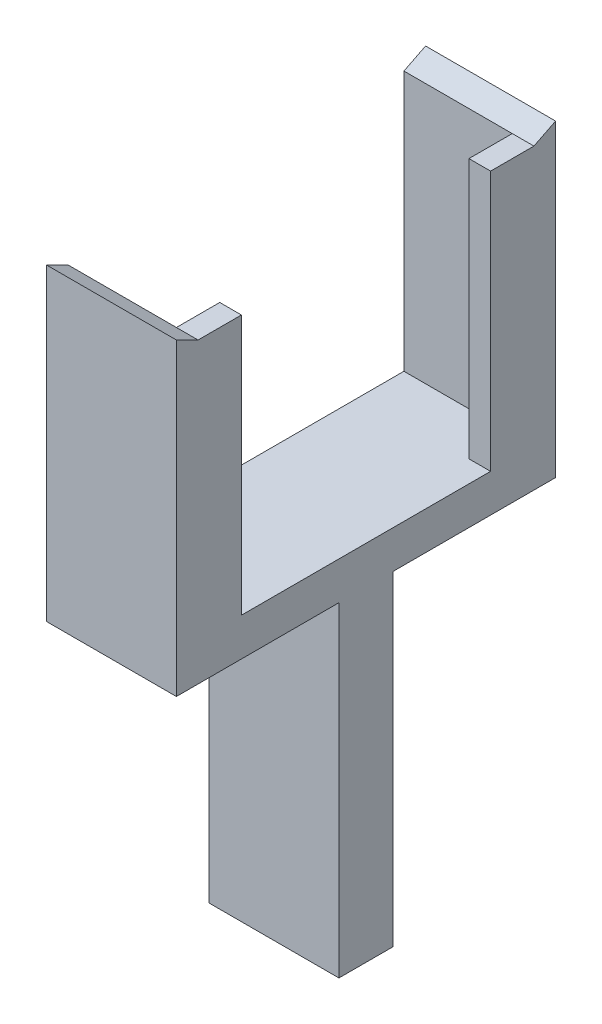
from build123d import *

# Parameters (mm, degrees)
BOSS_EXTRUDE1_DEPTH = 6
SKETCH2_W           = 2
SKETCH2_H           = 24
BOSS_EXTRUDE2_DEPTH = 4


with BuildPart() as part:
    # Sketch1 → Boss-Extrude1 (new, symmetric)
    with BuildSketch(Plane(origin=(0, 0, 0), x_dir=(0, 0, -1), z_dir=(1, 0, 0))):
        Polygon((-2.5, -27.858843537), (-2.5, 2.141156463), (-17.5, 2.141156463), (-17.5, 30.641156463), (-15.5, 29.641156463), (-15.5, 5.641156463), (15.5, 5.641156463), (15.5, 29.641156463), (17.5, 30.641156463), (17.5, 2.141156463), (2.5, 2.141156463), (2.5, -27.858843537), align=None)
    extrude(amount=BOSS_EXTRUDE1_DEPTH, both=True)

    # Sketch2 → Boss-Extrude2 (add)
    with BuildSketch(Plane(origin=(0, 0, 15.5), x_dir=(-1, 0, 0), z_dir=(0, 0, -1))):
        with Locations((-5, 17.641156463)):
            Rectangle(SKETCH2_W, SKETCH2_H)
    boss_extrude2 = extrude(amount=BOSS_EXTRUDE2_DEPTH)

    # Mirror1: Boss-Extrude2 across plane
    add(boss_extrude2.mirror(Plane(origin=(0, 0, 0), x_dir=(1, 0, 0), z_dir=(0, 0, -1))))


solid = part.part
